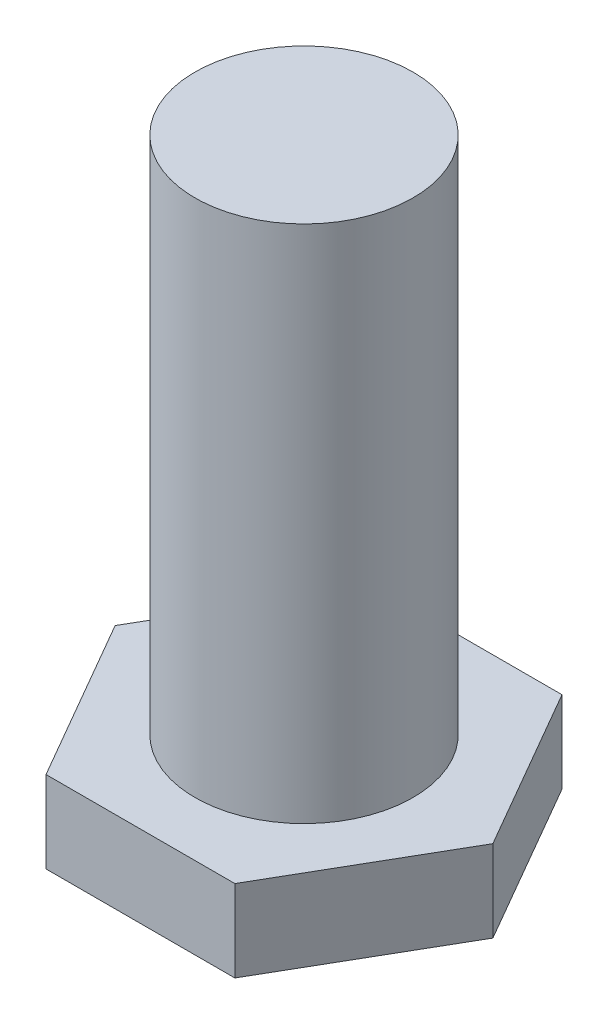
from build123d import *

# Parameters (mm, degrees)
SALIENTE_EXTRUIR1_DEPTH = 3
CROQUIS2_R              = 4
SALIENTE_EXTRUIR2_DEPTH = 19.05


with BuildPart() as part:
    # Croquis1 → Saliente-Extruir1 (new body)
    with BuildSketch(Plane(origin=(0, 0, 0), x_dir=(1, 0, 0), z_dir=(0, 1, 0))):
        Polygon((6.92820323, 0), (3.464101615, 6), (-3.464101615, 6), (-6.92820323, 0), (-3.464101615, -6), (3.464101615, -6), align=None)
    extrude(amount=SALIENTE_EXTRUIR1_DEPTH)

    # Croquis2 → Saliente-Extruir2 (add)
    with BuildSketch(Plane(origin=(0, 3, 0), x_dir=(1, 0, 0), z_dir=(0, 1, 0))):
        with Locations(Location((0, 0, 0), (0, 0, 90))):
            Circle(CROQUIS2_R)
    extrude(amount=SALIENTE_EXTRUIR2_DEPTH)


solid = part.part
